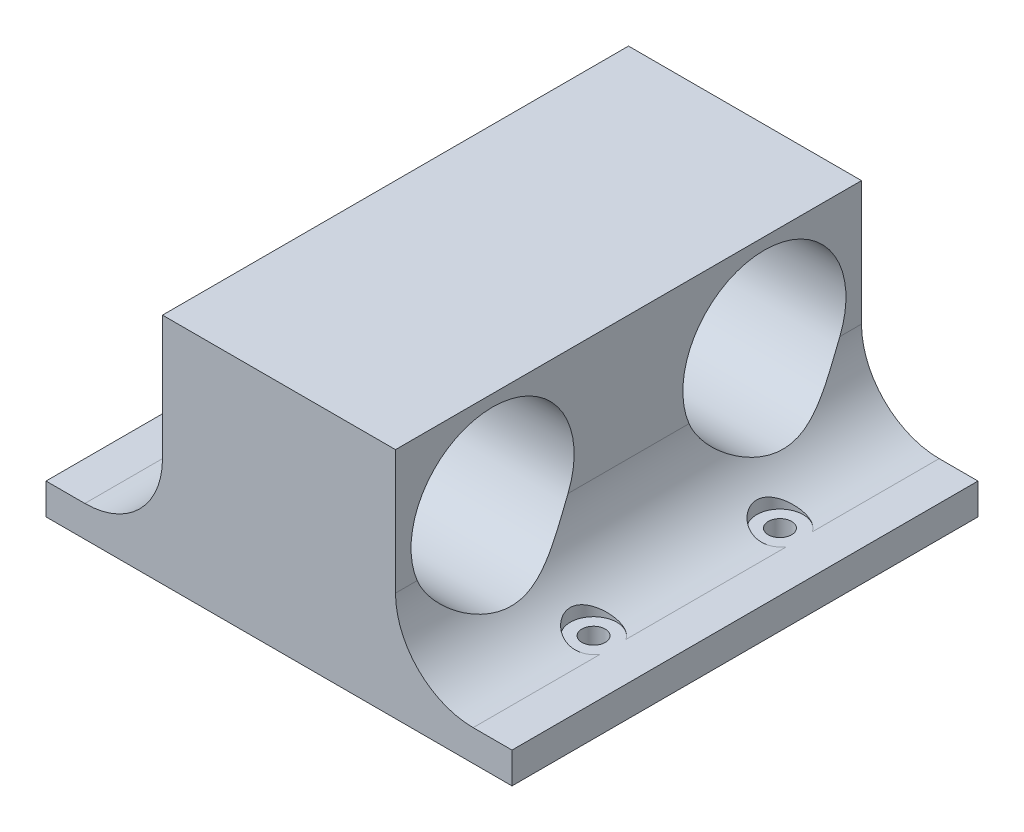
from build123d import *

# Parameters (mm, degrees)
BOSS_EXTRUDE1_DEPTH     = 30
CUT_EXTRUDE1_DEPTH      = 74.484692283
CUT_EXTRUDE1_DEPTH_BACK = 74.484692283
SKETCH6_R               = 10.5
CUT_EXTRUDE2_DEPTH      = 52.961524285
CUT_EXTRUDE2_DEPTH_BACK = 52.961524285
SKETCH7_R               = 1.5
SKETCH8_R               = 3
CUT_EXTRUDE3_DEPTH      = 10


with BuildPart() as part:
    # Sketch5 → Boss-Extrude1 (new, symmetric)
    with BuildSketch(Plane.XY):
        with BuildLine():
            Line((15, 30), (-15, 30))
            Line((-15, 30), (-15, 14))
            ThreePointArc((-15, 14), (-17.928932188, 6.928932188), (-25, 4))
            Line((-25, 4), (-30, 4))
            Line((-30, 4), (-30, 0))
            Line((-30, 0), (30, 0))
            Line((30, 0), (30, 4))
            Line((30, 4), (25, 4))
            ThreePointArc((25, 4), (17.928932188, 6.928932188), (15, 14))
            Line((15, 14), (15, 30))
        make_face()
    extrude(amount=BOSS_EXTRUDE1_DEPTH, both=True)

    # Sketch6 → Cut-Extrude1 (cut, two sides: drawn at the far end of the back side and taken through both)
    with BuildSketch(Plane(origin=(30, 0, 0), x_dir=(0, 0, -1), z_dir=(1, 0, 0)).offset(-CUT_EXTRUDE1_DEPTH_BACK)):
        with Locations(Location((-17.5, 18, 0), (0, 0, 337.607312195))):
            Circle(SKETCH6_R)
        with Locations(Location((17.5, 18, 0), (0, 0, 337.607312195))):
            Circle(SKETCH6_R)
    extrude(amount=CUT_EXTRUDE1_DEPTH + CUT_EXTRUDE1_DEPTH_BACK, mode=Mode.SUBTRACT)

    # Sketch7 → Cut-Extrude2 (cut, two sides: drawn at the far end of the back side and taken through both)
    with BuildSketch(Plane.XZ.offset(-CUT_EXTRUDE2_DEPTH_BACK)):
        with Locations(Location((-22.5, 12, 0), (0, 0, 270))):
            Circle(SKETCH7_R)
        with Locations(Location((22.5, 12, 0), (0, 0, 270))):
            Circle(SKETCH7_R)
        with Locations(Location((22.5, -12, 0), (0, 0, 270))):
            Circle(SKETCH7_R)
        with Locations(Location((-22.5, -12, 0), (0, 0, 270))):
            Circle(SKETCH7_R)
    extrude(amount=CUT_EXTRUDE2_DEPTH + CUT_EXTRUDE2_DEPTH_BACK, mode=Mode.SUBTRACT)

    # Sketch8 → Cut-Extrude3 (cut)
    with BuildSketch(Plane(origin=(0, 4, 0), x_dir=(1, 0, 0), z_dir=(0, 1, 0))):
        with Locations((22.5, -12)):
            Circle(SKETCH8_R)
        with Locations((22.5, 12)):
            Circle(SKETCH8_R)
        with Locations((-22.5, 12)):
            Circle(SKETCH8_R)
        with Locations((-22.5, -12)):
            Circle(SKETCH8_R)
    extrude(amount=CUT_EXTRUDE3_DEPTH, mode=Mode.SUBTRACT)


solid = part.part
